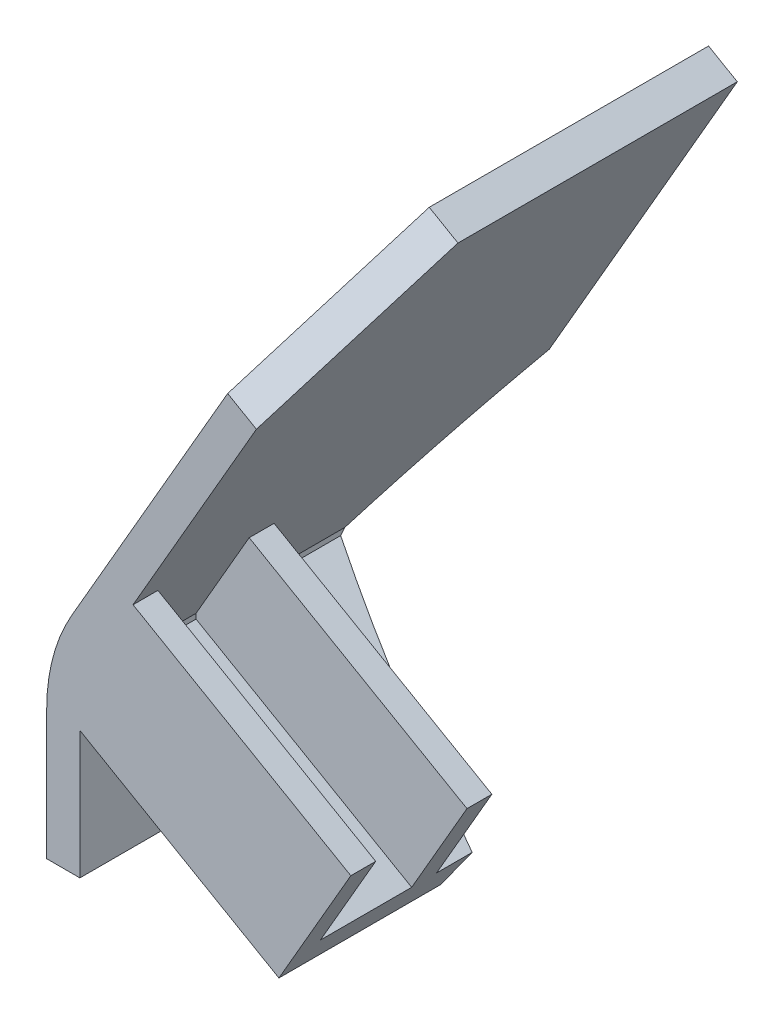
from build123d import *

# Parameters (mm, degrees)
SALIENTE_EXTRUIR1_DEPTH = 18
REDONDEO1_R             = 17
CROQUIS5_W              = 36
CROQUIS5_H              = 3
SALIENTE_EXTRUIR4_DEPTH = 15
CROQUIS6_W              = 15
CROQUIS6_H              = 2.25
SALIENTE_EXTRUIR5_DEPTH = 10
CROQUIS7_W              = 15
CROQUIS7_H              = 2.25
SALIENTE_EXTRUIR6_DEPTH = 10
SALIENTE_EXTRUIR7_REACH = 53.008
CROQUIS9_W              = 14.804118301
CROQUIS9_H              = 37.418244965
CORTAR_EXTRUIR1_DEPTH   = 65.529262729
CORTAR_EXTRUIR2_DEPTH   = 43.150382534
CROQUIS13_W             = 6.782058138
CROQUIS13_H             = 38.050659694
CORTAR_EXTRUIR4_DEPTH   = 66.385361662
CORTAR_EXTRUIR5_DEPTH   = 59.680118278
CROQUIS15_R             = 67.5
CORTAR_EXTRUIR6_DEPTH   = 53.753520742


with BuildPart() as part:
    # Croquis1 → Saliente-Extruir1 (new, symmetric)
    with BuildSketch(Plane.XY):
        Polygon((-23.009210442, -16.267830887), (-23.009210442, 0), (5.722840366, 49.765371804), (7.454891173, 46.765371804), (-20.009210442, -0.803847577), (-20.009210442, -16.267830887), align=None)
    extrude(amount=SALIENTE_EXTRUIR1_DEPTH, both=True)

    # Redondeo1
    redondeo1_edges = [part.edges().sort_by_distance(p)[0] for p in [
        (-23.009210442, 0, 0),
    ]]
    fillet(redondeo1_edges, radius=REDONDEO1_R)

    # Croquis8 → Saliente-Extruir7 (add, up to next)
    with BuildSketch(Plane(origin=(-7.962730425, 4.597284555, 0), x_dir=(0, 0, 1), z_dir=(-0.8660254037844399, 0.49999999999999806, 0)), mode=Mode.PRIVATE) as saliente_extruir7_sk1:
        Polygon((18, -14.092960033), (18, -1.092960033), (15.75, -1.092960033), (15.75, -11.092960033), (7.5, -11.092960033), (7.5, -1.092960033), (5.25, -1.092960033), (5.25, -11.092960033), (-18, -11.092960033), (-18, -14.092960033), align=None)
    saliente_extruir7_tool1 = extrude(saliente_extruir7_sk1.sketch, amount=SALIENTE_EXTRUIR7_REACH, mode=Mode.PRIVATE) - part.part


with BuildPart() as body_2:
    # Croquis5 → Saliente-Extruir4 (new body)
    with BuildSketch(Plane(origin=(-7.962730425, 4.597284555, 0), x_dir=(0, 0, -1), z_dir=(0.8660254037844398, -0.499999999999998, 0))):
        with Locations((0, -12.592960033)):
            Rectangle(CROQUIS5_W, CROQUIS5_H)
    extrude(amount=SALIENTE_EXTRUIR4_DEPTH)

    # Croquis6 → Saliente-Extruir5 (add)
    with BuildSketch(Plane(origin=(-5.546480017, -9.606785192, 0), x_dir=(0.8660254037844398, -0.49999999999999806, 0), z_dir=(0.499999999999998, 0.8660254037844397, 0))):
        with Locations((-1.694569109, -16.875)):
            Rectangle(CROQUIS6_W, CROQUIS6_H)
    extrude(amount=SALIENTE_EXTRUIR5_DEPTH)

    # Croquis7 → Saliente-Extruir6 (add)
    with BuildSketch(Plane(origin=(-5.546480017, -9.606785192, 0), x_dir=(0.8660254037844398, -0.49999999999999806, 0), z_dir=(0.499999999999998, 0.8660254037844397, 0))):
        with Locations((-1.694569109, -6.375)):
            Rectangle(CROQUIS7_W, CROQUIS7_H)
    extrude(amount=SALIENTE_EXTRUIR6_DEPTH)


with BuildPart() as part_1:
    add(part.part)

    add(body_2.part)  # Saliente-Extruir7 merges body 2
    add(saliente_extruir7_tool1.solids().sort_by_distance((-11.75921, -1.978412, 17.617247))[0])

    # Croquis9 → Cortar-Extruir1 (cut, through all)
    with BuildSketch(Plane(origin=(0, 41.27, 0), x_dir=(1, 0, 0), z_dir=(0, 1, 0))):
        with Locations((0.741451059, 0.142817729)):
            Rectangle(CROQUIS9_W, CROQUIS9_H)
    extrude(amount=CORTAR_EXTRUIR1_DEPTH, mode=Mode.SUBTRACT)

    # Croquis11 → Cortar-Extruir2 (cut, through all)
    with BuildSketch(Plane(origin=(-17.256907831, 9.963280382, 0), x_dir=(0, 0, 1), z_dir=(-0.8660254037844386, 0.5000000000000003, 0))):
        Polygon((8.788629382, 36.149885998), (18, 36.149885998), (18, 23.351498504), align=None)
    extrude(amount=-CORTAR_EXTRUIR2_DEPTH, mode=Mode.SUBTRACT)

    # Croquis13 → Cortar-Extruir4 (cut, through all)
    with BuildSketch(Plane(origin=(18.074942999, 31.306719618, 0), x_dir=(-0.8660254037844386, 0.4999999999999999, 0), z_dir=(-0.49999999999999994, -0.8660254037844387, 0))):
        with Locations((17.8722453, 0.046357502)):
            Rectangle(CROQUIS13_W, CROQUIS13_H)
    extrude(amount=-CORTAR_EXTRUIR4_DEPTH, mode=Mode.SUBTRACT)

    # Croquis14 → Cortar-Extruir5 (cut, through all)
    with BuildSketch(Plane(origin=(7.886305076, 13.659481075, 21.914651455), x_dir=(0.9563939122686984, -0.15449956154835387, -0.24787208406099226), z_dir=(0.29207992840209546, 0.5058972758635086, 0.8116386275298311))):
        Polygon((-2.921520295, 29.452632093), (-8.700629296, 32.1607213), (-16.69781327, 15.094592988), (-10.918704269, 12.386503781), align=None)
    extrude(amount=CORTAR_EXTRUIR5_DEPTH, mode=Mode.SUBTRACT)

    # Croquis15 → Cortar-Extruir6 (cut, through all)
    with BuildSketch(Plane.ZY.offset(23.009210442)):
        with Locations((-57.422816505, -44.474628196)):
            Circle(CROQUIS15_R)
    extrude(amount=-CORTAR_EXTRUIR6_DEPTH, mode=Mode.SUBTRACT)


solid = part_1.part
